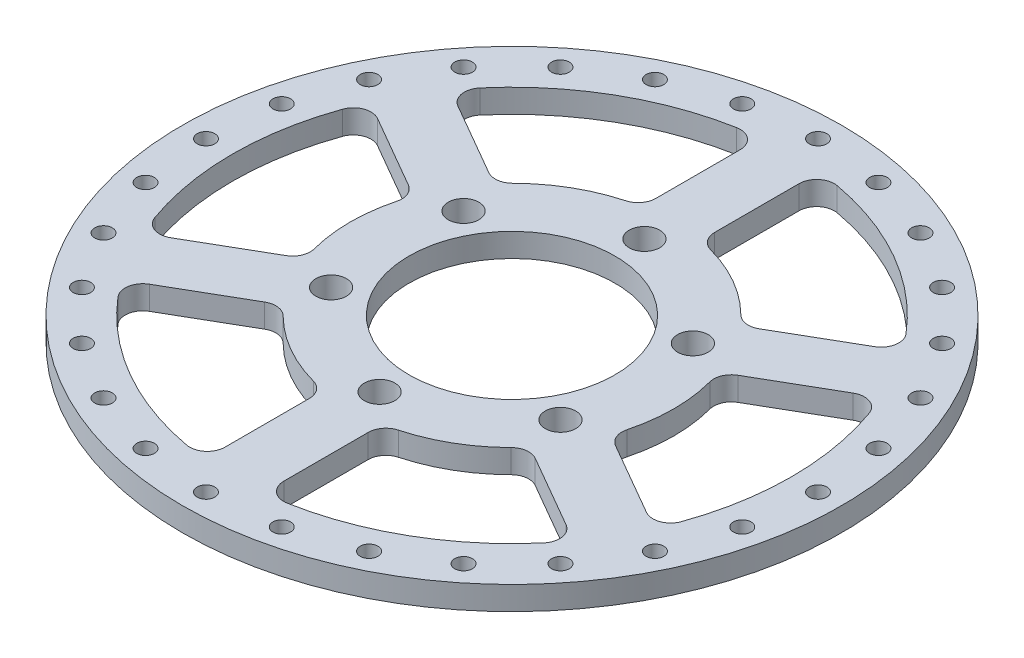
from build123d import *

# Parameters (mm, degrees)
SKETCH_1_R      = 56
SKETCH_1_R_2    = 2.6
SKETCH_1_R_3    = 17.5
SKETCH_1_R_4    = 1.5
EXTRUDE_1_DEPTH = 4
FILLET_1_R      = 3


with BuildPart() as part:
    # 草图1 → 凸台-拉伸1 (new body)
    with BuildSketch(Plane(origin=(0, 0, 0), x_dir=(1, 0, 0), z_dir=(0, 1, 0))):
        with Locations(Location((0, 0, 0), (0, 0, 270))):
            Circle(SKETCH_1_R)
        with BuildLine():
            Line((-5, 47.236109069), (-5, 27.041634566))
            ThreePointArc((-5, 27.041634566), (-13.75, 23.815698604), (-20.918742494, 17.850944302))
            Line((-20.918742494, 17.850944302), (-38.40767043, 27.948181554))
            ThreePointArc((-38.40767043, 27.948181554), (-23.75, 41.13620668), (-5, 47.236109069))
        make_face(mode=Mode.SUBTRACT)
        with BuildLine():
            Line((-43.40767043, 19.287927516), (-25.918742494, 9.190690264))
            ThreePointArc((-25.918742494, 9.190690264), (-27.5, 0), (-25.918742494, -9.190690264))
            Line((-25.918742494, -9.190690264), (-43.40767043, -19.287927516))
            ThreePointArc((-43.40767043, -19.287927516), (-47.5, 0), (-43.40767043, 19.287927516))
        make_face(mode=Mode.SUBTRACT)
        with BuildLine():
            Line((-38.40767043, -27.948181554), (-20.918742494, -17.850944302))
            ThreePointArc((-20.918742494, -17.850944302), (-13.75, -23.815698604), (-5, -27.041634566))
            Line((-5, -27.041634566), (-5, -47.236109069))
            ThreePointArc((-5, -47.236109069), (-23.75, -41.13620668), (-38.40767043, -27.948181554))
        make_face(mode=Mode.SUBTRACT)
        with BuildLine():
            Line((5, -47.236109069), (5, -27.041634566))
            ThreePointArc((5, -27.041634566), (13.75, -23.815698604), (20.918742494, -17.850944302))
            Line((20.918742494, -17.850944302), (38.40767043, -27.948181554))
            ThreePointArc((38.40767043, -27.948181554), (23.75, -41.13620668), (5, -47.236109069))
        make_face(mode=Mode.SUBTRACT)
        with BuildLine():
            Line((43.40767043, -19.287927516), (25.918742494, -9.190690264))
            ThreePointArc((25.918742494, -9.190690264), (27.5, 0), (25.918742494, 9.190690264))
            Line((25.918742494, 9.190690264), (43.40767043, 19.287927516))
            ThreePointArc((43.40767043, 19.287927516), (47.5, 0), (43.40767043, -19.287927516))
        make_face(mode=Mode.SUBTRACT)
        with BuildLine():
            Line((38.40767043, 27.948181554), (20.918742494, 17.850944302))
            ThreePointArc((20.918742494, 17.850944302), (13.75, 23.815698604), (5, 27.041634566))
            Line((5, 27.041634566), (5, 47.236109069))
            ThreePointArc((5, 47.236109069), (23.75, 41.13620668), (38.40767043, 27.948181554))
        make_face(mode=Mode.SUBTRACT)
        with Locations(Location((0, 22.5, 0), (0, 0, 270))):
            Circle(SKETCH_1_R_2, mode=Mode.SUBTRACT)
        with Locations(Location((-19.485571585, -11.25, 0), (0, 0, 270))):
            Circle(SKETCH_1_R_2, mode=Mode.SUBTRACT)
        with Locations(Location((0, -22.5, 0), (0, 0, 270))):
            Circle(SKETCH_1_R_2, mode=Mode.SUBTRACT)
        with Locations(Location((19.485571585, -11.25, 0), (0, 0, 270))):
            Circle(SKETCH_1_R_2, mode=Mode.SUBTRACT)
        with Locations(Location((-19.485571585, 11.25, 0), (0, 0, 270))):
            Circle(SKETCH_1_R_2, mode=Mode.SUBTRACT)
        with Locations(Location((0, 0, 0), (0, 0, 270))):
            Circle(SKETCH_1_R_3, mode=Mode.SUBTRACT)
        with Locations(Location((19.485571585, 11.25, 0), (0, 0, 270))):
            Circle(SKETCH_1_R_2, mode=Mode.SUBTRACT)
        with Locations(Location((-32.421469697, -40.655237088, 0), (0, 0, 270))):
            Circle(SKETCH_1_R_4, mode=Mode.SUBTRACT)
        with Locations(Location((-40.655237088, -32.421469697, 0), (0, 0, 270))):
            Circle(SKETCH_1_R_4, mode=Mode.SUBTRACT)
        with Locations(Location((-22.561954434, -46.850381131, 0), (0, 0, 270))):
            Circle(SKETCH_1_R_4, mode=Mode.SUBTRACT)
        with Locations(Location((-11.571088566, -50.696251433, 0), (0, 0, 270))):
            Circle(SKETCH_1_R_4, mode=Mode.SUBTRACT)
        with Locations(Location((-46.850381131, -22.561954434, 0), (0, 0, 270))):
            Circle(SKETCH_1_R_4, mode=Mode.SUBTRACT)
        with Locations(Location((-50.696251433, -11.571088566, 0), (0, 0, 270))):
            Circle(SKETCH_1_R_4, mode=Mode.SUBTRACT)
        with Locations(Location((-52, 0, 0), (0, 0, 270))):
            Circle(SKETCH_1_R_4, mode=Mode.SUBTRACT)
        with Locations(Location((0, -52, 0), (0, 0, 270))):
            Circle(SKETCH_1_R_4, mode=Mode.SUBTRACT)
        with Locations(Location((11.571088566, -50.696251433, 0), (0, 0, 270))):
            Circle(SKETCH_1_R_4, mode=Mode.SUBTRACT)
        with Locations(Location((22.561954434, -46.850381131, 0), (0, 0, 270))):
            Circle(SKETCH_1_R_4, mode=Mode.SUBTRACT)
        with Locations(Location((32.421469697, -40.655237088, 0), (0, 0, 270))):
            Circle(SKETCH_1_R_4, mode=Mode.SUBTRACT)
        with Locations(Location((40.655237088, -32.421469697, 0), (0, 0, 270))):
            Circle(SKETCH_1_R_4, mode=Mode.SUBTRACT)
        with Locations(Location((46.850381131, -22.561954434, 0), (0, 0, 270))):
            Circle(SKETCH_1_R_4, mode=Mode.SUBTRACT)
        with Locations(Location((50.696251433, -11.571088566, 0), (0, 0, 270))):
            Circle(SKETCH_1_R_4, mode=Mode.SUBTRACT)
        with Locations(Location((-50.696251433, 11.571088566, 0), (0, 0, 270))):
            Circle(SKETCH_1_R_4, mode=Mode.SUBTRACT)
        with Locations(Location((-46.850381131, 22.561954434, 0), (0, 0, 270))):
            Circle(SKETCH_1_R_4, mode=Mode.SUBTRACT)
        with Locations(Location((-40.655237088, 32.421469697, 0), (0, 0, 270))):
            Circle(SKETCH_1_R_4, mode=Mode.SUBTRACT)
        with Locations(Location((-32.421469697, 40.655237088, 0), (0, 0, 270))):
            Circle(SKETCH_1_R_4, mode=Mode.SUBTRACT)
        with Locations(Location((-22.561954434, 46.850381131, 0), (0, 0, 270))):
            Circle(SKETCH_1_R_4, mode=Mode.SUBTRACT)
        with Locations(Location((-11.571088566, 50.696251433, 0), (0, 0, 270))):
            Circle(SKETCH_1_R_4, mode=Mode.SUBTRACT)
        with Locations(Location((40.655237088, 32.421469697, 0), (0, 0, 270))):
            Circle(SKETCH_1_R_4, mode=Mode.SUBTRACT)
        with Locations(Location((22.561954434, 46.850381131, 0), (0, 0, 270))):
            Circle(SKETCH_1_R_4, mode=Mode.SUBTRACT)
        with Locations(Location((11.571088566, 50.696251433, 0), (0, 0, 270))):
            Circle(SKETCH_1_R_4, mode=Mode.SUBTRACT)
        with Locations(Location((0, 52, 0), (0, 0, 270))):
            Circle(SKETCH_1_R_4, mode=Mode.SUBTRACT)
        with Locations(Location((46.850381131, 22.561954434, 0), (0, 0, 270))):
            Circle(SKETCH_1_R_4, mode=Mode.SUBTRACT)
        with Locations(Location((32.421469697, 40.655237088, 0), (0, 0, 270))):
            Circle(SKETCH_1_R_4, mode=Mode.SUBTRACT)
        with Locations(Location((52, 0, 0), (0, 0, 270))):
            Circle(SKETCH_1_R_4, mode=Mode.SUBTRACT)
        with Locations(Location((50.696251433, 11.571088566, 0), (0, 0, 270))):
            Circle(SKETCH_1_R_4, mode=Mode.SUBTRACT)
    extrude(amount=EXTRUDE_1_DEPTH)

    # 圆角1
    fillet_1_edges = [part.edges().sort_by_distance(p)[0] for p in [
        (5, 2, 27.041634566),
        (5, 2, 47.236109069),
        (38.40767043, 2, 27.948181554),
        (20.918742494, 2, 17.850944302),
        (43.40767043, 2, -19.287927516),
        (25.918742494, 2, -9.190690264),
        (25.918742494, 2, 9.190690264),
        (43.40767043, 2, 19.287927516),
        (5, 2, -47.236109069),
        (5, 2, -27.041634566),
        (20.918742494, 2, -17.850944302),
        (38.40767043, 2, -27.948181554),
        (-38.40767043, 2, -27.948181554),
        (-20.918742494, 2, -17.850944302),
        (-5, 2, -27.041634566),
        (-5, 2, -47.236109069),
        (-43.40767043, 2, 19.287927516),
        (-25.918742494, 2, 9.190690264),
        (-25.918742494, 2, -9.190690264),
        (-43.40767043, 2, -19.287927516),
        (-5, 2, 47.236109069),
        (-5, 2, 27.041634566),
        (-20.918742494, 2, 17.850944302),
        (-38.40767043, 2, 27.948181554),
    ]]
    fillet(fillet_1_edges, radius=FILLET_1_R)


solid = part.part
